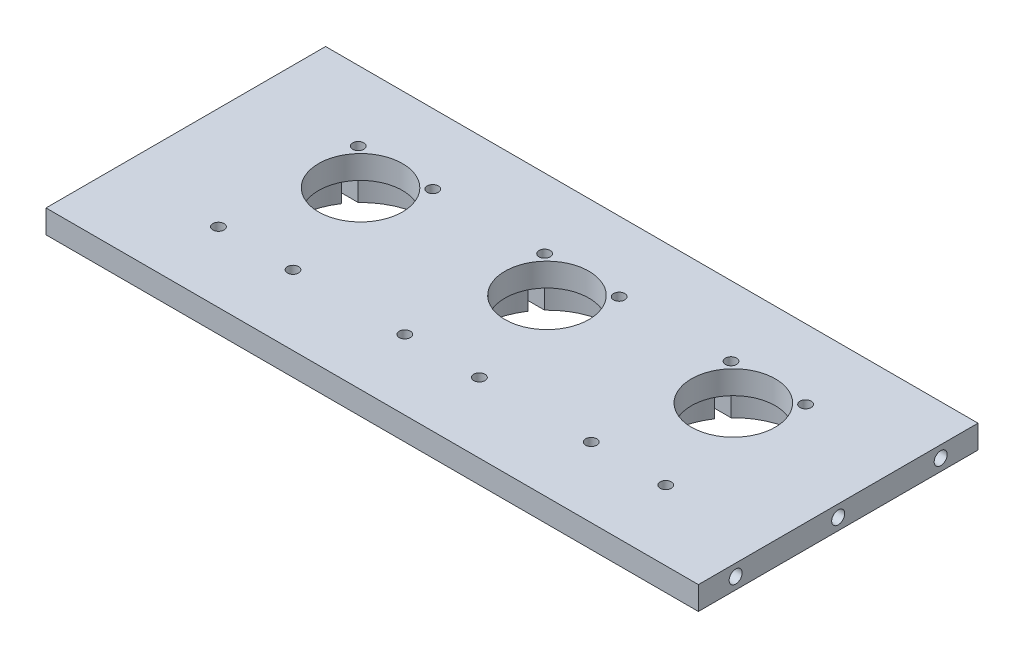
from build123d import *

# Parameters (mm, degrees)
SKETCH_1_W             = 140
SKETCH_1_H             = 60
EXTRUDE_1_DEPTH        = 5
SKETCH_2_R             = 1.2
SKETCH_2_R_2           = 9
CUT_EXTRUDE_872_DEPTH  = 153.397506541
SKETCH_4_R             = 1.4
CUT_EXTRUDE_3_DEPTH    = 5
PATTERN_LINEAR_1_COUNT = 3
PATTERN_LINEAR_1_PITCH = 40
EXTRUDE_5_DEPTH        = 8
SKETCH_6_R             = 2
CUT_EXTRUDE_4_DEPTH    = 1


with BuildPart() as part:
    # 草图1 → 凸台-拉伸1 (new body)
    with BuildSketch(Plane(origin=(0, 0, 0), x_dir=(1, 0, 0), z_dir=(0, 1, 0))):
        with Locations((70, -30)):
            Rectangle(SKETCH_1_W, SKETCH_1_H)
    extrude(amount=EXTRUDE_1_DEPTH)

    # 草图2 → Cut-Extrude 872 (cut, through all)
    with BuildSketch(Plane(origin=(0, 5, 0), x_dir=(1, 0, 0), z_dir=(0, 1, 0))):
        with Locations((102, -15)):
            Circle(SKETCH_2_R)
        with Locations((118, -15)):
            Circle(SKETCH_2_R)
        with Locations((102, -45)):
            Circle(SKETCH_2_R)
        with Locations((118, -45)):
            Circle(SKETCH_2_R)
        with Locations((110, -22.5)):
            Circle(SKETCH_2_R_2)
    cut_extrude_872 = extrude(amount=-CUT_EXTRUDE_872_DEPTH, mode=Mode.SUBTRACT)

    # 草图4 → 切除-拉伸3 (cut)
    with BuildSketch(Plane.ZY):
        with Locations((30, 2.5)):
            Circle(SKETCH_4_R)
        with Locations((8, 2.5)):
            Circle(SKETCH_4_R)
        with Locations((52, 2.5)):
            Circle(SKETCH_4_R)
    cut_extrude_3 = extrude(amount=-CUT_EXTRUDE_3_DEPTH, mode=Mode.SUBTRACT)

    # 镜向1: 切除-拉伸3 across plane
    add(cut_extrude_3.mirror(Plane(origin=(70, 0, 0), x_dir=(0, 0, 1), z_dir=(1, 0, 0))), mode=Mode.SUBTRACT)

    # 阵列(线性)1: Cut-Extrude 872 ×3
    with Locations(*[(-i * PATTERN_LINEAR_1_PITCH, 0, 0) for i in range(1, PATTERN_LINEAR_1_COUNT)]):
        add(cut_extrude_872, mode=Mode.SUBTRACT)

    # 草图5 → 凸台-拉伸5 (add)
    with BuildSketch(Plane.XZ):
        with BuildLine():
            Line((3.1, 14.5), (17.906613378, 14.5))
            ThreePointArc((17.906613378, 14.5), (30, 37), (42.093386622, 14.5))
            Line((42.093386622, 14.5), (57.906613378, 14.5))
            ThreePointArc((57.906613378, 14.5), (70, 37), (82.093386622, 14.5))
            Line((82.093386622, 14.5), (97.906613378, 14.5))
            ThreePointArc((97.906613378, 14.5), (110, 37), (122.093386622, 14.5))
            Line((122.093386622, 14.5), (124.43086969, 14.5))
            ThreePointArc((124.43086969, 14.5), (111.104849123, 38.962967789), (94.629573851, 16.5))
            Line((94.629573851, 16.5), (85.370426149, 16.5))
            ThreePointArc((85.370426149, 16.5), (70, 39), (54.629573851, 16.5))
            Line((54.629573851, 16.5), (45.370426149, 16.5))
            ThreePointArc((45.370426149, 16.5), (30, 39), (14.629573851, 16.5))
            Line((14.629573851, 16.5), (3.1, 16.5))
            Line((3.1, 16.5), (3.1, 14.5))
        make_face()
        with BuildLine():
            Line((19.5, 12.5), (3.1, 12.5))
            Line((3.1, 12.5), (3.1, 10.5))
            Line((3.1, 10.5), (18.675248347, 10.5))
            ThreePointArc((18.675248347, 10.5), (30, 6), (41.324751653, 10.5))
            Line((41.324751653, 10.5), (58.675248347, 10.5))
            ThreePointArc((58.675248347, 10.5), (70, 6), (81.324751653, 10.5))
            Line((81.324751653, 10.5), (98.675248347, 10.5))
            ThreePointArc((98.675248347, 10.5), (111.345246377, 6.05493046), (123.124404748, 12.5))
            Line((123.124404748, 12.5), (120.5, 12.5))
            ThreePointArc((120.5, 12.5), (110, 8), (99.5, 12.5))
            Line((99.5, 12.5), (80.5, 12.5))
            ThreePointArc((80.5, 12.5), (80.253048327, 12.246951673), (80, 12))
            ThreePointArc((80, 12), (69.646446609, 8.004310986), (59.5, 12.5))
            Line((59.5, 12.5), (40.5, 12.5))
            ThreePointArc((40.5, 12.5), (40.253048327, 12.246951673), (40, 12))
            ThreePointArc((40, 12), (29.646446609, 8.004310986), (19.5, 12.5))
        make_face()
    extrude(amount=EXTRUDE_5_DEPTH)

    # 草图6 → 切除-拉伸4 (cut)
    with BuildSketch(Plane.XZ):
        with Locations((22, 45)):
            Circle(SKETCH_6_R)
        with Locations((38, 45)):
            Circle(SKETCH_6_R)
        with Locations((62, 45)):
            Circle(SKETCH_6_R)
        with Locations((78, 45)):
            Circle(SKETCH_6_R)
        with Locations((102, 45)):
            Circle(SKETCH_6_R)
        with Locations((118, 45)):
            Circle(SKETCH_6_R)
    extrude(amount=-CUT_EXTRUDE_4_DEPTH, mode=Mode.SUBTRACT)


solid = part.part
